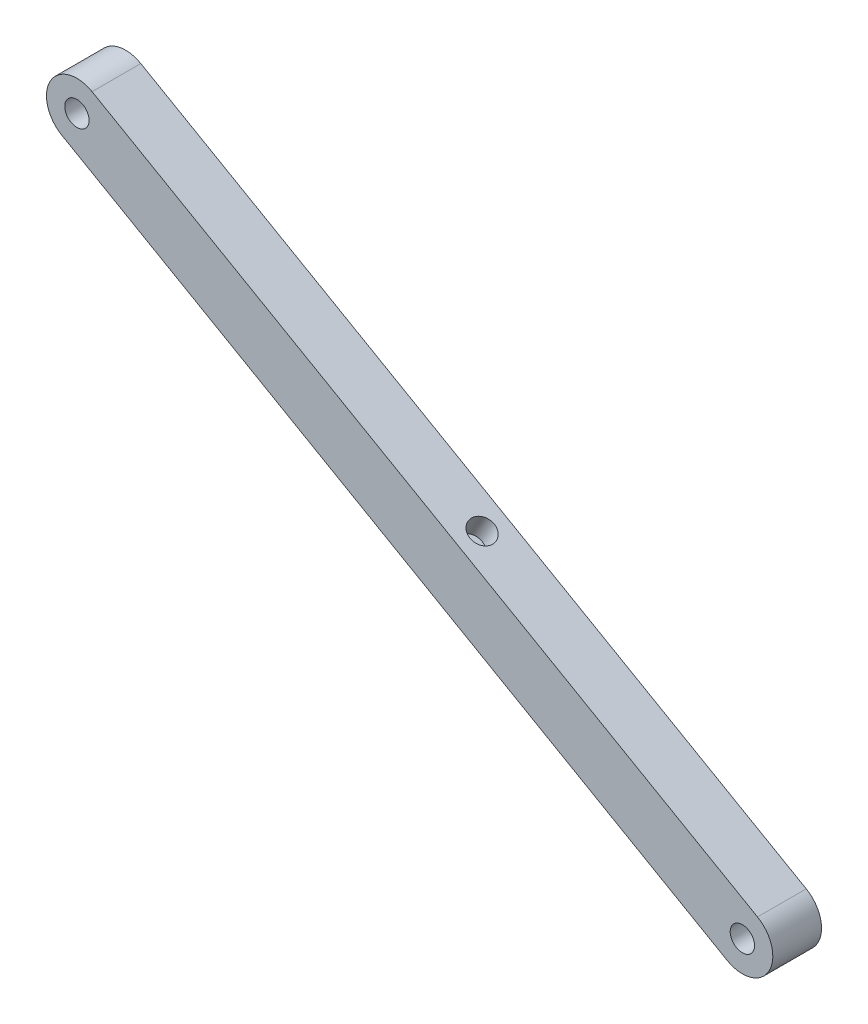
from build123d import *

# Parameters (mm, degrees)
SKETCH1_R           = 1
BOSS_EXTRUDE1_DEPTH = 4
SKETCH2_R           = 1
CUT_EXTRUDE1_DEPTH  = 2


with BuildPart() as part:
    # Sketch1 → Boss-Extrude1 (new body)
    with BuildSketch(Plane.XY):
        with BuildLine():
            Line((-58.658434206, 64.576544266), (-4.020390364, 33.212804613))
            ThreePointArc((-4.020390364, 33.212804613), (-3.096806864, 29.800035426), (-6.509576051, 28.876451927))
            Line((-6.509576051, 28.876451927), (-61.147619893, 60.24019158))
            ThreePointArc((-61.147619893, 60.24019158), (-62.071203393, 63.652960767), (-58.658434206, 64.576544266))
        make_face()
        with Locations((-59.90302705, 62.408367923)):
            Circle(SKETCH1_R, mode=Mode.SUBTRACT)
        with Locations((-5.264983207, 31.04462827)):
            Circle(SKETCH1_R, mode=Mode.SUBTRACT)
    extrude(amount=BOSS_EXTRUDE1_DEPTH)

    # Sketch2 → Cut-Extrude1 (cut)
    with BuildSketch(Plane(origin=(13.343522454, 23.245441166, 0), x_dir=(0.8672705371832455, -0.49783713735908147, 0), z_dir=(0.49783713735908147, 0.8672705371832455, 0))):
        with Locations(Location((-48.403705156, -2, 0), (0, 0, 180))):
            Circle(SKETCH2_R)
    extrude(amount=-CUT_EXTRUDE1_DEPTH, mode=Mode.SUBTRACT)


solid = part.part
